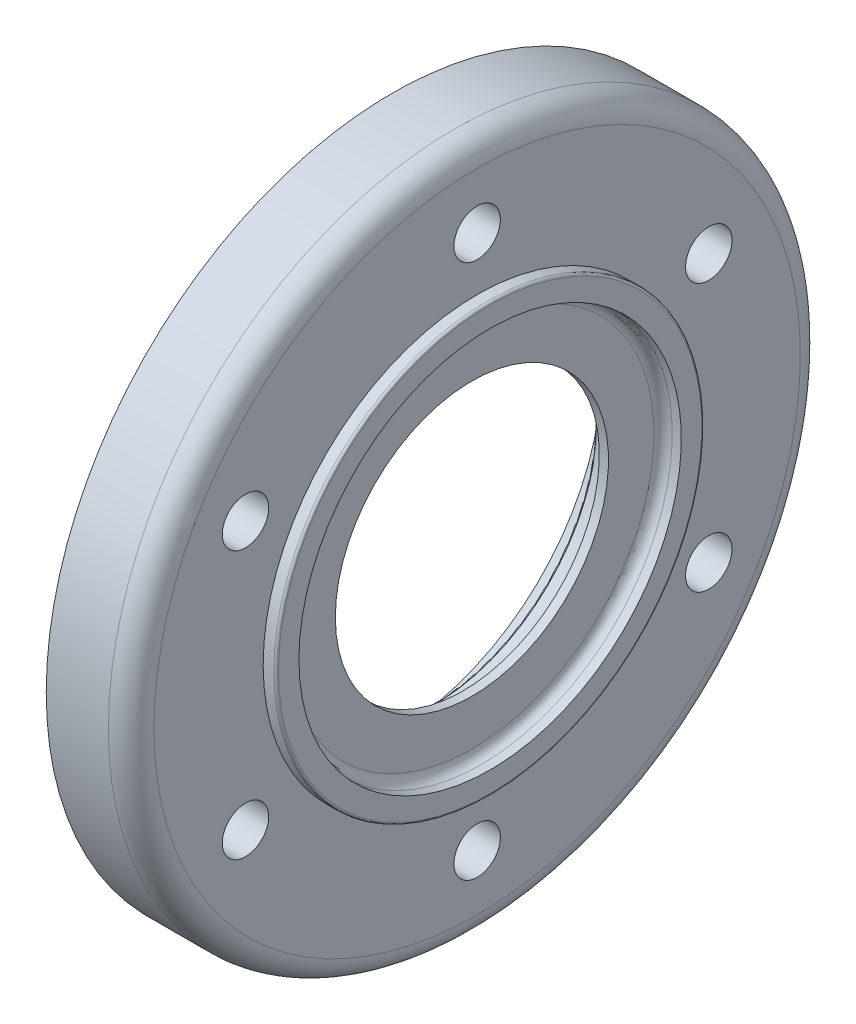
from build123d import *

# Parameters (mm, degrees)
FILLET1_R                   = 0.5
FILLET4_R                   = 0.5
BOSS_EXTRUDE2_START         = 18.65
SKETCH3_R                   = 76
SKETCH3_R_2                 = 46
BOSS_EXTRUDE2_DEPTH         = 18.65
FILLET5_R                   = 5
M12X1_75_TAPPED_HOLE1_D     = 10.2
M12X1_75_TAPPED_HOLE1_DEPTH = 29.25
M12X1_75_TAPPED_HOLE1_TIP   = 3.064389157
SKETCH6_W                   = 6.000865062
SKETCH6_H                   = 152
CUT_EXTRUDE2_DEPTH          = 99


with BuildPart() as part:
    # Sketch1 → Revolve1 (revolve)
    with BuildSketch(Plane(origin=(0, 0, 0), x_dir=(1, 0, 0), z_dir=(0, 1, 0)), mode=Mode.PRIVATE) as revolve1_sk:
        with BuildLine():
            Line((0.595225647, 30), (2.595225647, 30))
            Line((2.595225647, 30), (2.595225647, 40))
            ThreePointArc((2.595225647, 40), (3.181012085, 41.414213562), (4.595225647, 42))
            Line((4.595225647, 42), (6.595225647, 42))
            Line((6.595225647, 42), (6.595225647, 47))
            Line((6.595225647, 47), (3.744360585, 47))
            Line((3.744360585, 47), (3.744360585, 76))
            Line((3.744360585, 76), (-2.255639415, 76))
            Line((-2.255639415, 76), (-2.255639415, 49))
            ThreePointArc((-2.255639415, 49), (-3.134319072, 46.878679656), (-5.255639415, 46))
            Line((-5.255639415, 46), (-6.404774353, 46))
            Line((-6.404774353, 46), (-6.404774353, 36))
            Line((-6.404774353, 36), (0.595225647, 36))
            Line((0.595225647, 36), (0.595225647, 30))
        make_face()
    revolve(revolve1_sk.sketch.rotate(Axis((0, 0, 0), (1, 0, 0)), 180), axis=Axis((0, 0, 0), (1, 0, 0)))

    # Fillet1
    fillet1_edges = [part.edges().sort_by_distance(p)[0] for p in [
        (-6.404774353, 0, -36),
    ]]
    fillet(fillet1_edges, radius=FILLET1_R)

    # Fillet4
    fillet4_edges = [part.edges().sort_by_distance(p)[0] for p in [
        (6.595225647, 0, -47),
    ]]
    fillet(fillet4_edges, radius=FILLET4_R)

    # Sketch3 → Boss-Extrude2 (add)
    with BuildSketch(Plane.ZY.offset(2.255639415).offset(BOSS_EXTRUDE2_START)):
        Circle(SKETCH3_R)
        with Locations(Location((0, 0, 0), (0, 0, 180))):
            Circle(SKETCH3_R_2, mode=Mode.SUBTRACT)
    extrude(amount=-BOSS_EXTRUDE2_DEPTH)

    # Fillet5
    fillet5_edges = [part.edges().sort_by_distance(p)[0] for p in [
        (3.744360585, 0, -76),
    ]]
    fillet(fillet5_edges, radius=FILLET5_R)

    # M12x1.75 Tapped Hole1
    with Locations(Plane(origin=(3.744360585, 0, 0), x_dir=(0, 0, -1), z_dir=(1, 0, 0))):
        with Locations((0, 58.75), (50.878992472, 29.375), (50.878992472, -29.375), (0, -58.75), (-50.878992472, -29.375), (-50.878992472, 29.375)):
            Hole(M12X1_75_TAPPED_HOLE1_D / 2, depth=M12X1_75_TAPPED_HOLE1_DEPTH)
            with Locations((0, 0, -(M12X1_75_TAPPED_HOLE1_DEPTH + M12X1_75_TAPPED_HOLE1_TIP / 2))):  # 118° drill point
                Cone(0, M12X1_75_TAPPED_HOLE1_D / 2, M12X1_75_TAPPED_HOLE1_TIP, mode=Mode.SUBTRACT)

    # Sketch6 → Cut-Extrude2 (cut, symmetric)
    with BuildSketch(Plane(origin=(0, 0, 0), x_dir=(1, 0, 0), z_dir=(0, 1, 0))):
        with Locations((-17.905206884, 0)):
            Rectangle(SKETCH6_W, SKETCH6_H)
    extrude(amount=CUT_EXTRUDE2_DEPTH, both=True, mode=Mode.SUBTRACT)


solid = part.part
